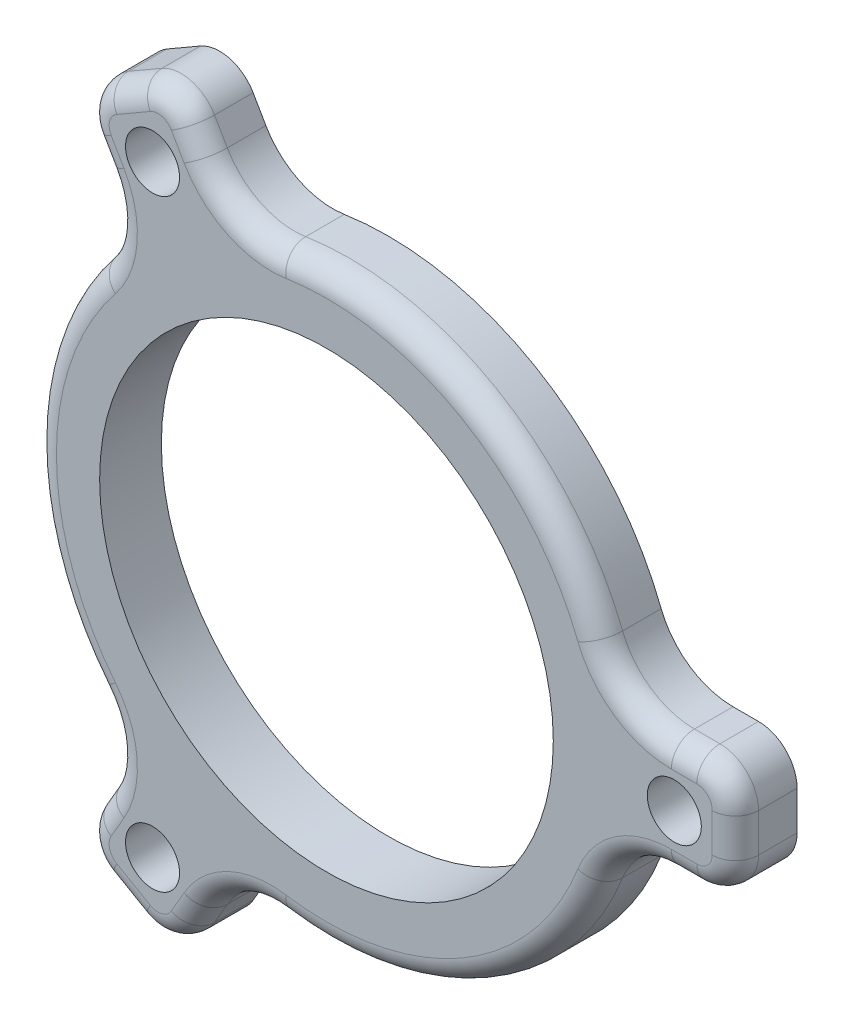
from build123d import *

# Parameters (mm, degrees)
SKETCH1_R           = 29.400000026
SKETCH1_R_2         = 3.5
BOSS_EXTRUDE1_DEPTH = 8
FILLET1_R           = 3


with BuildPart() as part:
    # Sketch1 → Boss-Extrude1 (new body)
    with BuildSketch(Plane.XY):
        with BuildLine():
            Line((-28.843288881, -34.9580418), (-30.495190528, -37.819219382))
            ThreePointArc((-30.495190528, -37.819219382), (-30.994692641, -41.613314607), (-28.665063509, -44.649346401))
            Line((-28.665063509, -44.649346401), (-24.334936491, -47.149346401))
            ThreePointArc((-24.334936491, -47.149346401), (-20.540841265, -47.648848513), (-17.504809472, -45.319219382))
            Line((-17.504809472, -45.319219382), (-15.852907825, -42.4580418))
            ThreePointArc((-15.852907825, -42.4580418), (-11.527824655, -38.446588336), (-5.694184248, -37.570949758))
            ThreePointArc((-5.694184248, -37.570949758), (19, -32.908965344), (35.384489059, -13.854166667))
            ThreePointArc((35.384489059, -13.854166667), (39.059634515, -9.239905166), (44.696196706, -7.5))
            Line((44.696196706, -7.5), (48, -7.5))
            ThreePointArc((48, -7.5), (51.535533906, -6.035533906), (53, -2.5))
            Line((53, -2.5), (53, 2.5))
            ThreePointArc((53, 2.5), (51.535533906, 6.035533906), (48, 7.5))
            Line((48, 7.5), (44.696196706, 7.5))
            ThreePointArc((44.696196706, 7.5), (39.059634515, 9.239905166), (35.384489059, 13.854166667))
            ThreePointArc((35.384489059, 13.854166667), (19, 32.908965344), (-5.694184248, 37.570949758))
            ThreePointArc((-5.694184248, 37.570949758), (-11.527824655, 38.446588336), (-15.852907825, 42.4580418))
            Line((-15.852907825, 42.4580418), (-17.504809472, 45.319219382))
            ThreePointArc((-17.504809472, 45.319219382), (-20.540841265, 47.648848513), (-24.334936491, 47.149346401))
            Line((-24.334936491, 47.149346401), (-28.665063509, 44.649346401))
            ThreePointArc((-28.665063509, 44.649346401), (-30.994692641, 41.613314607), (-30.495190528, 37.819219382))
            Line((-30.495190528, 37.819219382), (-28.843288881, 34.9580418))
            ThreePointArc((-28.843288881, 34.9580418), (-27.53180986, 29.20668317), (-29.690304811, 23.716783092))
            ThreePointArc((-29.690304811, 23.716783092), (-32.237173632, 20.118763287), (-34.35021834, 16.25))
            ThreePointArc((-34.35021834, 16.25), (-37.744312009, -4.400785266), (-29.690304811, -23.716783092))
            ThreePointArc((-29.690304811, -23.716783092), (-27.53180986, -29.20668317), (-28.843288881, -34.9580418))
        make_face()
        Circle(SKETCH1_R, mode=Mode.SUBTRACT)
        with Locations((45.084761958, 0)):
            Circle(SKETCH1_R_2, mode=Mode.SUBTRACT)
        with Locations((-22.542380979, -39.044549179)):
            Circle(SKETCH1_R_2, mode=Mode.SUBTRACT)
        with Locations((-22.542380979, 39.044549179)):
            Circle(SKETCH1_R_2, mode=Mode.SUBTRACT)
    extrude(amount=BOSS_EXTRUDE1_DEPTH)

    # Fillet1
    fillet1_edges = [part.edges().sort_by_distance(p)[0] for p in [
        (-27.53180986, 29.20668317, 8),
        (-27.53180986, -29.20668317, 8),
        (-29.669239705, -36.388630591, 8),
        (-30.994692641, -41.613314607, 8),
        (-26.5, -45.899346401, 8),
        (-20.540841265, -47.648848513, 8),
        (-16.678858648, -43.888630591, 8),
        (-11.527824655, -38.446588336, 8),
        (19, -32.908965344, 8),
        (39.059634515, -9.239905166, 8),
        (46.348098353, -7.5, 8),
        (-38, 0, 8),
        (51.535533906, -6.035533906, 8),
        (53, 0, 8),
        (51.535533906, 6.035533906, 8),
        (46.348098353, 7.5, 8),
        (39.059634515, 9.239905166, 8),
        (19, 32.908965344, 8),
        (-11.527824655, 38.446588336, 8),
        (-16.678858648, 43.888630591, 8),
        (-20.540841265, 47.648848513, 8),
        (-26.5, 45.899346401, 8),
        (-30.994692641, 41.613314607, 8),
        (-29.669239705, 36.388630591, 8),
    ]]
    fillet(fillet1_edges, radius=FILLET1_R)


solid = part.part
